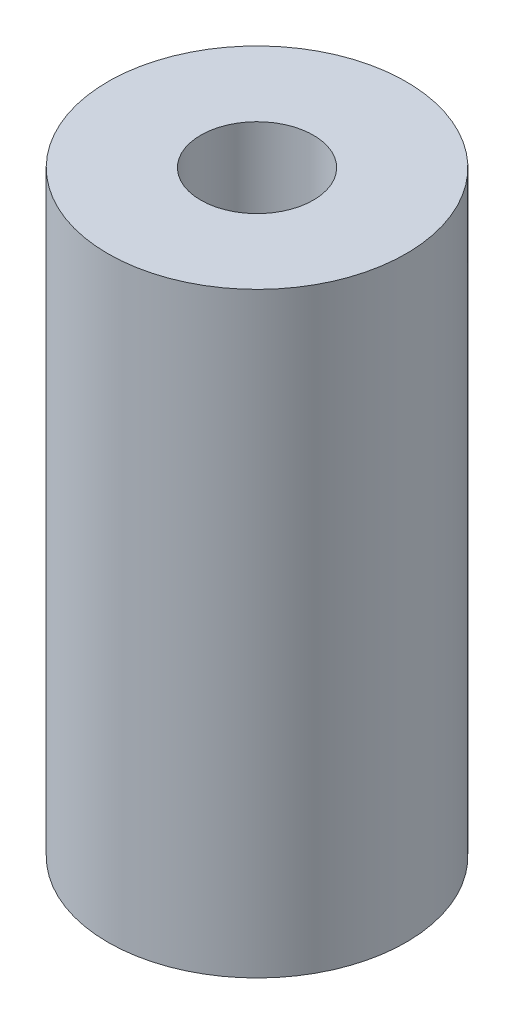
from build123d import *

# Parameters (mm, degrees)
SKETCH1_R           = 4.5
BOSS_EXTRUDE1_DEPTH = 18
SKETCH2_R           = 1.7
CUT_EXTRUDE1_DEPTH  = 8
SKETCH3_R           = 2.5
CUT_EXTRUDE2_DEPTH  = 8


with BuildPart() as part:
    # Sketch1 → Boss-Extrude1 (new body)
    with BuildSketch(Plane(origin=(0, 0, 0), x_dir=(1, 0, 0), z_dir=(0, 1, 0))):
        with Locations(Location((0, 0, 0), (0, 0, 270))):
            Circle(SKETCH1_R)
    extrude(amount=BOSS_EXTRUDE1_DEPTH)

    # Sketch2 → Cut-Extrude1 (cut)
    with BuildSketch(Plane(origin=(0, 18, 0), x_dir=(1, 0, 0), z_dir=(0, 1, 0))):
        with Locations(Location((0, 0, 0), (0, 0, 270))):
            Circle(SKETCH2_R)
    extrude(amount=-CUT_EXTRUDE1_DEPTH, mode=Mode.SUBTRACT)

    # Sketch3 → Cut-Extrude2 (cut)
    with BuildSketch(Plane.XZ):
        with Locations(Location((0, 0, 0), (0, 0, 270))):
            Circle(SKETCH3_R)
    extrude(amount=-CUT_EXTRUDE2_DEPTH, mode=Mode.SUBTRACT)


solid = part.part
